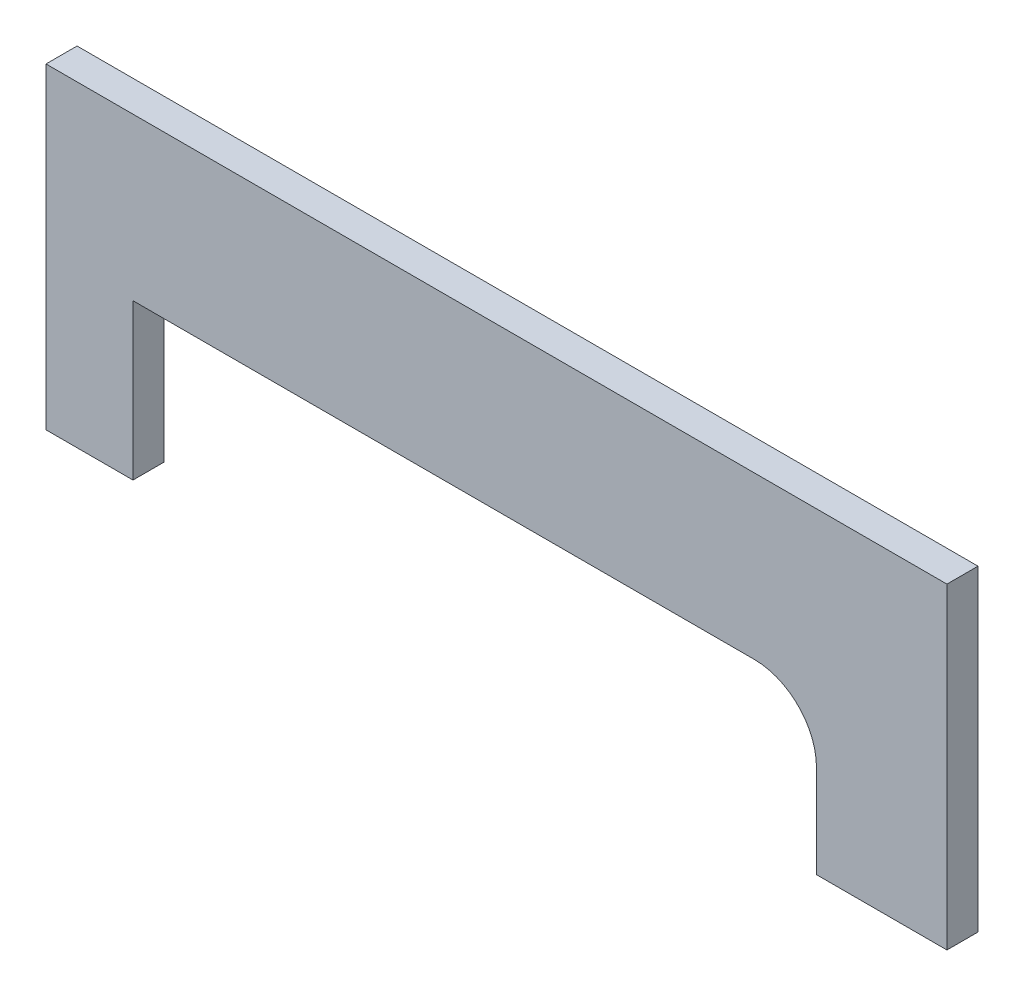
from build123d import *

# Parameters (mm, degrees)
EXTRUSION1_DEPTH = 5
EXTRUSION2_REACH = 109.744


with BuildPart() as part:
    # Esquisse1 → Extrusion1 (new body)
    with BuildSketch(Plane.XY):
        Polygon((-48.749448329, -48.162307692), (-34.749448329, -48.162307692), (-34.749448329, -23.162307692), (25.250551671, -23.162307692), (25.250551671, -48.162307692), (96.250551671, -48.162307692), (96.250551671, 2.837692308), (-48.749448329, 2.837692308), align=None)
    extrude(amount=EXTRUSION1_DEPTH)

    # Esquisse3 → Extrusion2 (cut, up to next)
    with BuildSketch(Plane(origin=(0, 0, 0), x_dir=(-1, 0, 0), z_dir=(0, 0, -1)), mode=Mode.PRIVATE) as extrusion2_sk1:
        with BuildLine():
            Line((-25.250551671, -23.162307692), (-65.250551671, -23.162307692))
            ThreePointArc((-65.250551671, -23.162307692), (-72.321619482, -26.09123988), (-75.250551671, -33.162307692))
            Line((-75.250551671, -33.162307692), (-75.250551671, -48.162307692))
            Line((-75.250551671, -48.162307692), (-25.250551671, -48.162307692))
            Line((-25.250551671, -48.162307692), (-25.250551671, -23.162307692))
        make_face()
    extrusion2_tool1 = extrude(extrusion2_sk1.sketch, amount=-EXTRUSION2_REACH, mode=Mode.PRIVATE) & part.part
    add(extrusion2_tool1.solids().sort_by_distance((49.852869, -35.84164, 0))[0], mode=Mode.SUBTRACT)


solid = part.part
